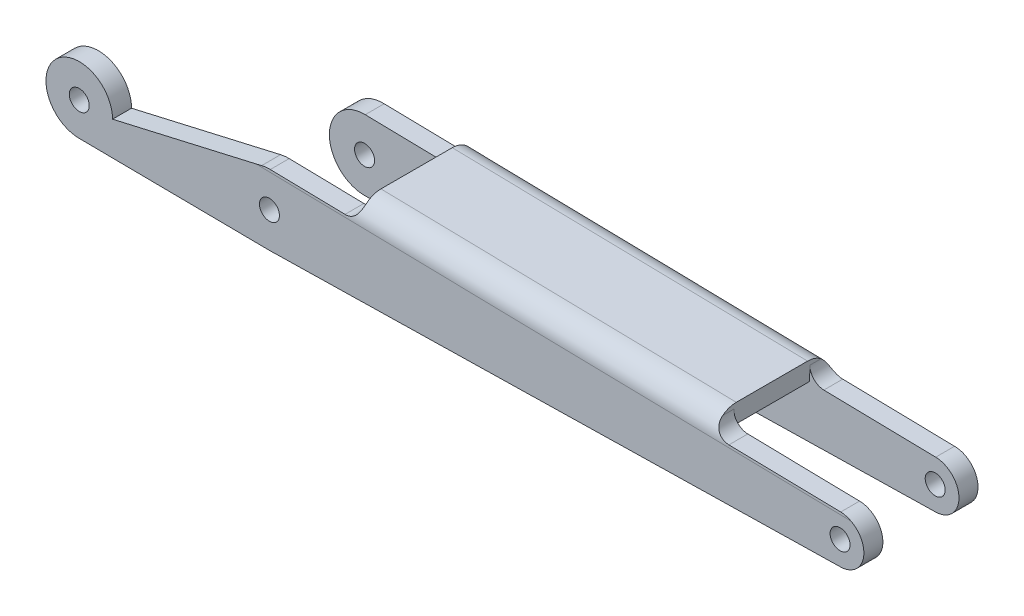
from build123d import *

# Parameters (mm, degrees)
BOSS_EXTRUDE1_DEPTH = 4
BOSS_EXTRUDE2_DEPTH = 4
SKETCH9_W           = 74.744017839
SKETCH9_H           = 24
BOSS_EXTRUDE3_DEPTH = 4
FILLET1_R           = 4.5
FILLET2_R           = 3
SKETCH10_R          = 2.1
CUT_EXTRUDE1_DEPTH  = 128.760117479


with BuildPart() as part:
    # Sketch3 → Boss-Extrude1 (new body)
    with BuildSketch(Plane.XY.offset(-7.75)):
        with BuildLine():
            Line((-1.659393939, 7.211547112), (-33, 0))
            ThreePointArc((-33, 0), (-44.924936548, 4.974434641), (-40.07, -6.999649991))
            Line((-40.07, -6.999649991), (-0.074, -7.399629991))
            ThreePointArc((-0.074, -7.399629991), (0.036988131, -7.399907559), (0.147967941, -7.398520493))
            Line((0.147967941, -7.398520493), (120.099988734, -4.999520111))
            ThreePointArc((120.099988734, -4.999520111), (125.000519882, 0), (120.099988734, 4.999520111))
            Line((120.099988734, 4.999520111), (0.147967941, 7.398520493))
            ThreePointArc((0.147967941, 7.398520493), (-0.761473505, 7.360717227), (-1.659393939, 7.211547112))
        make_face()
    extrude(amount=-BOSS_EXTRUDE1_DEPTH)



with BuildPart() as body_2:
    # Sketch8 → Boss-Extrude2 (new body)
    with BuildSketch(Plane(origin=(0, 0, -27.75), x_dir=(-1, 0, 0), z_dir=(0, 0, -1))):
        with BuildLine():
            Line((-120.099988734, -4.999520111), (-0.147967941, -7.398520493))
            ThreePointArc((-0.147967941, -7.398520493), (7.4, 0), (-0.147967941, 7.398520493))
            Line((-0.147967941, 7.398520493), (-120.099988734, 4.999520111))
            ThreePointArc((-120.099988734, 4.999520111), (-125.000519882, 0), (-120.099988734, -4.999520111))
        make_face()
    extrude(amount=BOSS_EXTRUDE2_DEPTH)


with BuildPart() as part_1:
    add(part.part)

    add(body_2.part)  # Boss-Extrude3 merges body 2
    # Sketch9 → Boss-Extrude3 (add)
    with BuildSketch(Plane(origin=(0.147967941, 7.398520493, 0), x_dir=(0.999800066650892, -0.019995667652563644, 0), z_dir=(0.019995667652563644, 0.999800066650892, 0))):
        with Locations((56.086957222, 19.75)):
            Rectangle(SKETCH9_W, SKETCH9_H)
    extrude(amount=BOSS_EXTRUDE3_DEPTH)

    # Fillet1
    fillet1_edges = [part_1.edges().sort_by_distance(p)[0] for p in [
        (56.30369418, 10.276224604, -7.75),
        (56.30369418, 10.276224604, -31.75),
    ]]
    fillet(fillet1_edges, radius=FILLET1_R)

    # Fillet2
    fillet2_edges = [part_1.edges().sort_by_distance(p)[0] for p in [
        (18.8591745, 7.024302607, -9.763932023),
        (18.8591745, 7.024302607, -29.736067977),
        (93.588248518, 5.529746067, -9.763932023),
        (93.588248518, 5.529746067, -29.736067977),
    ]]
    fillet(fillet2_edges, radius=FILLET2_R)

    # Sketch10 → Cut-Extrude1 (cut, through all)
    with BuildSketch(Plane.XY.offset(-7.75)):
        with Locations((-40, 0)):
            Circle(SKETCH10_R)
        Circle(SKETCH10_R)
        with Locations((120, 0)):
            Circle(SKETCH10_R)
    extrude(amount=-CUT_EXTRUDE1_DEPTH, mode=Mode.SUBTRACT)


solid = part_1.part
